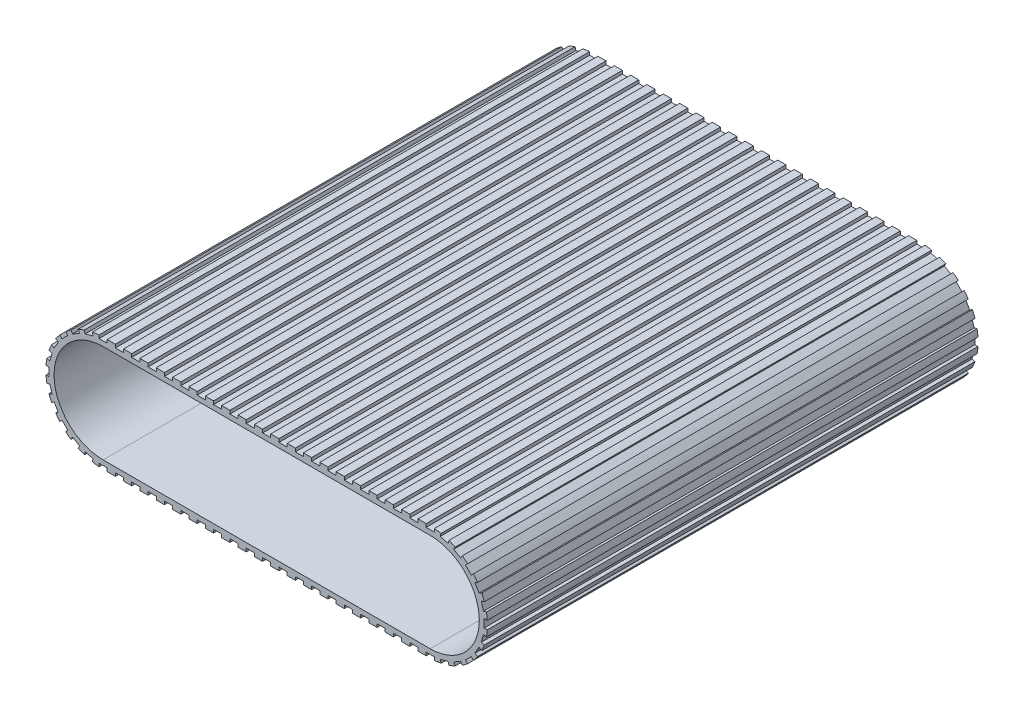
from build123d import *

# Parameters (mm, degrees)
EXTRUDE_1_DEPTH           = 150
SKETCH_2_W                = 5
SKETCH_2_H                = 300
CUT_EXTRUDE_1_DEPTH       = 2
SKETCH_3_W                = 300
SKETCH_3_H                = 5
CUT_EXTRUDE_2_DEPTH       = 2
PATTERN_CIRCULAR_1_COUNT  = 6
PATTERN_CIRCULAR_1_ANGLE  = 75
MIRROR_2_COPY_1_SKETCH_W  = 300
MIRROR_2_COPY_1_SKETCH_H  = 5
MIRROR_2_COPY_1_DEPTH     = 2
MIRROR_2_COPY_2_SKETCH_W  = 300
MIRROR_2_COPY_2_SKETCH_H  = 5
MIRROR_2_COPY_2_DEPTH     = 2
MIRROR_2_COPY_3_SKETCH_W  = 300
MIRROR_2_COPY_3_SKETCH_H  = 5
MIRROR_2_COPY_3_DEPTH     = 2
MIRROR_2_COPY_4_SKETCH_W  = 300
MIRROR_2_COPY_4_SKETCH_H  = 5
MIRROR_2_COPY_4_DEPTH     = 2
MIRROR_2_COPY_5_SKETCH_W  = 300
MIRROR_2_COPY_5_SKETCH_H  = 5
MIRROR_2_COPY_5_DEPTH     = 2
MIRROR_2_COPY_6_SKETCH_W  = 300
MIRROR_2_COPY_6_SKETCH_H  = 5
MIRROR_2_COPY_6_DEPTH     = 2
MIRROR_3_COPY_1_SKETCH_W  = 300
MIRROR_3_COPY_1_SKETCH_H  = 5
MIRROR_3_COPY_1_DEPTH     = 2
MIRROR_3_COPY_2_SKETCH_W  = 300
MIRROR_3_COPY_2_SKETCH_H  = 5
MIRROR_3_COPY_2_DEPTH     = 2
MIRROR_3_COPY_3_SKETCH_W  = 300
MIRROR_3_COPY_3_SKETCH_H  = 5
MIRROR_3_COPY_3_DEPTH     = 2
MIRROR_3_COPY_4_SKETCH_W  = 300
MIRROR_3_COPY_4_SKETCH_H  = 5
MIRROR_3_COPY_4_DEPTH     = 2
MIRROR_3_COPY_5_SKETCH_W  = 300
MIRROR_3_COPY_5_SKETCH_H  = 5
MIRROR_3_COPY_5_DEPTH     = 2
MIRROR_3_COPY_6_SKETCH_W  = 300
MIRROR_3_COPY_6_SKETCH_H  = 5
MIRROR_3_COPY_6_DEPTH     = 2
MIRROR_3_COPY_7_SKETCH_W  = 300
MIRROR_3_COPY_7_SKETCH_H  = 5
MIRROR_3_COPY_7_DEPTH     = 2
MIRROR_3_COPY_8_SKETCH_W  = 300
MIRROR_3_COPY_8_SKETCH_H  = 5
MIRROR_3_COPY_8_DEPTH     = 2
MIRROR_3_COPY_9_SKETCH_W  = 300
MIRROR_3_COPY_9_SKETCH_H  = 5
MIRROR_3_COPY_9_DEPTH     = 2
MIRROR_3_COPY_10_SKETCH_W = 300
MIRROR_3_COPY_10_SKETCH_H = 5
MIRROR_3_COPY_10_DEPTH    = 2
MIRROR_3_COPY_11_SKETCH_W = 300
MIRROR_3_COPY_11_SKETCH_H = 5
MIRROR_3_COPY_11_DEPTH    = 2
MIRROR_3_COPY_12_SKETCH_W = 300
MIRROR_3_COPY_12_SKETCH_H = 5
MIRROR_3_COPY_12_DEPTH    = 2
MIRROR_3_COPY_13_SKETCH_W = 300
MIRROR_3_COPY_13_SKETCH_H = 5
MIRROR_3_COPY_13_DEPTH    = 2


with BuildPart() as part:
    # 草图1 → 凸台-拉伸1 (new, symmetric)
    with BuildSketch(Plane.XY):
        with BuildLine():
            Line((-100, 35), (100, 35))
            ThreePointArc((100, 35), (135, 0), (100, -35))
            Line((100, -35), (-100, -35))
            ThreePointArc((-100, -35), (-135, 0), (-100, 35))
        make_face()
        with BuildLine():
            Line((-100, 30), (100, 30))
            ThreePointArc((100, 30), (130, 0), (100, -30))
            Line((100, -30), (-100, -30))
            ThreePointArc((-100, -30), (-130, 0), (-100, 30))
        make_face(mode=Mode.SUBTRACT)
    extrude(amount=EXTRUDE_1_DEPTH, both=True)

    # 草图2 → 切除-拉伸1 (cut)
    with BuildSketch(Plane(origin=(0, 35, 0), x_dir=(1, 0, 0), z_dir=(0, 1, 0))):
        Rectangle(SKETCH_2_W, SKETCH_2_H)
        with Locations((10, 0)):
            Rectangle(SKETCH_2_W, SKETCH_2_H)
        with Locations((20, 0)):
            Rectangle(SKETCH_2_W, SKETCH_2_H)
        with Locations((30, 0)):
            Rectangle(SKETCH_2_W, SKETCH_2_H)
        with Locations((40, 0)):
            Rectangle(SKETCH_2_W, SKETCH_2_H)
        with Locations((50, 0)):
            Rectangle(SKETCH_2_W, SKETCH_2_H)
        with Locations((60, 0)):
            Rectangle(SKETCH_2_W, SKETCH_2_H)
        with Locations((70, 0)):
            Rectangle(SKETCH_2_W, SKETCH_2_H)
        with Locations((80, 0)):
            Rectangle(SKETCH_2_W, SKETCH_2_H)
        with Locations((90, 0)):
            Rectangle(SKETCH_2_W, SKETCH_2_H)
        with Locations((100, 0)):
            Rectangle(SKETCH_2_W, SKETCH_2_H)
        with Locations((-100, 0)):
            Rectangle(SKETCH_2_W, SKETCH_2_H)
        with Locations((-90, 0)):
            Rectangle(SKETCH_2_W, SKETCH_2_H)
        with Locations((-80, 0)):
            Rectangle(SKETCH_2_W, SKETCH_2_H)
        with Locations((-70, 0)):
            Rectangle(SKETCH_2_W, SKETCH_2_H)
        with Locations((-60, 0)):
            Rectangle(SKETCH_2_W, SKETCH_2_H)
        with Locations((-50, 0)):
            Rectangle(SKETCH_2_W, SKETCH_2_H)
        with Locations((-40, 0)):
            Rectangle(SKETCH_2_W, SKETCH_2_H)
        with Locations((-30, 0)):
            Rectangle(SKETCH_2_W, SKETCH_2_H)
        with Locations((-20, 0)):
            Rectangle(SKETCH_2_W, SKETCH_2_H)
        with Locations((-10, 0)):
            Rectangle(SKETCH_2_W, SKETCH_2_H)
    cut_extrude_1 = extrude(amount=-CUT_EXTRUDE_1_DEPTH, mode=Mode.SUBTRACT)

    # 镜向1: 切除-拉伸1 across plane
    add(cut_extrude_1.mirror(Plane.ZX), mode=Mode.SUBTRACT)

    # 草图3 → 切除-拉伸2 (cut)
    with BuildSketch(Plane(origin=(135, 0, 0), x_dir=(0, 0, -1), z_dir=(1, 0, 0))):
        Rectangle(SKETCH_3_W, SKETCH_3_H)
    cut_extrude_2 = extrude(amount=-CUT_EXTRUDE_2_DEPTH, mode=Mode.SUBTRACT)

    # 阵列(圆周)1: 切除-拉伸2 ×6 about axis
    pattern_circular_1_axis = Axis((100, 0, 0), (0, 0, 1))
    for i in range(1, PATTERN_CIRCULAR_1_COUNT):
        add(cut_extrude_2.rotate(pattern_circular_1_axis, i * PATTERN_CIRCULAR_1_ANGLE / (PATTERN_CIRCULAR_1_COUNT - 1)), mode=Mode.SUBTRACT)

    # 镜向2 copy 1 sketch → 镜向2 copy 1 (cut)
    with BuildSketch(Plane(origin=(133.80740392, -9.058666579, 0), x_dir=(0, 0, -1), z_dir=(0.9659258262890681, -0.25881904510252135, 0))):
        Rectangle(MIRROR_2_COPY_1_SKETCH_W, MIRROR_2_COPY_1_SKETCH_H)
    extrude(amount=-MIRROR_2_COPY_1_DEPTH, mode=Mode.SUBTRACT)

    # 镜向2 copy 2 sketch → 镜向2 copy 2 (cut)
    with BuildSketch(Plane(origin=(130.310889132, -17.5, 0), x_dir=(0, 0, -1), z_dir=(0.866025403784438, -0.500000000000001, 0))):
        Rectangle(MIRROR_2_COPY_2_SKETCH_W, MIRROR_2_COPY_2_SKETCH_H)
    extrude(amount=-MIRROR_2_COPY_2_DEPTH, mode=Mode.SUBTRACT)

    # 镜向2 copy 3 sketch → 镜向2 copy 3 (cut)
    with BuildSketch(Plane(origin=(124.748737342, -24.748737342, 0), x_dir=(0, 0, -1), z_dir=(0.7071067811865462, -0.7071067811865488, 0))):
        Rectangle(MIRROR_2_COPY_3_SKETCH_W, MIRROR_2_COPY_3_SKETCH_H)
    extrude(amount=-MIRROR_2_COPY_3_DEPTH, mode=Mode.SUBTRACT)

    # 镜向2 copy 4 sketch → 镜向2 copy 4 (cut)
    with BuildSketch(Plane(origin=(117.5, -30.310889132, 0), x_dir=(0, 0, -1), z_dir=(0.499999999999998, -0.8660254037844398, 0))):
        Rectangle(MIRROR_2_COPY_4_SKETCH_W, MIRROR_2_COPY_4_SKETCH_H)
    extrude(amount=-MIRROR_2_COPY_4_DEPTH, mode=Mode.SUBTRACT)

    # 镜向2 copy 5 sketch → 镜向2 copy 5 (cut)
    with BuildSketch(Plane(origin=(109.058666579, -33.80740392, 0), x_dir=(0, 0, -1), z_dir=(0.25881904510251796, -0.9659258262890691, 0))):
        Rectangle(MIRROR_2_COPY_5_SKETCH_W, MIRROR_2_COPY_5_SKETCH_H)
    extrude(amount=-MIRROR_2_COPY_5_DEPTH, mode=Mode.SUBTRACT)

    # 镜向2 copy 6 sketch → 镜向2 copy 6 (cut)
    with BuildSketch(Plane(origin=(135, 0, 0), x_dir=(0, 0, -1), z_dir=(1, 0, 0))):
        Rectangle(MIRROR_2_COPY_6_SKETCH_W, MIRROR_2_COPY_6_SKETCH_H)
    extrude(amount=-MIRROR_2_COPY_6_DEPTH, mode=Mode.SUBTRACT)

    # 镜向3 copy 1 sketch → 镜向3 copy 1 (cut)
    with BuildSketch(Plane(origin=(-133.80740392, 9.058666579, 0), x_dir=(0, 0, -1), z_dir=(-0.9659258262890681, 0.25881904510252135, 0))):
        Rectangle(MIRROR_3_COPY_1_SKETCH_W, MIRROR_3_COPY_1_SKETCH_H)
    extrude(amount=-MIRROR_3_COPY_1_DEPTH, mode=Mode.SUBTRACT)

    # 镜向3 copy 2 sketch → 镜向3 copy 2 (cut)
    with BuildSketch(Plane(origin=(-130.310889132, 17.5, 0), x_dir=(0, 0, -1), z_dir=(-0.866025403784438, 0.500000000000001, 0))):
        Rectangle(MIRROR_3_COPY_2_SKETCH_W, MIRROR_3_COPY_2_SKETCH_H)
    extrude(amount=-MIRROR_3_COPY_2_DEPTH, mode=Mode.SUBTRACT)

    # 镜向3 copy 3 sketch → 镜向3 copy 3 (cut)
    with BuildSketch(Plane(origin=(-124.748737342, 24.748737342, 0), x_dir=(0, 0, -1), z_dir=(-0.7071067811865462, 0.7071067811865488, 0))):
        Rectangle(MIRROR_3_COPY_3_SKETCH_W, MIRROR_3_COPY_3_SKETCH_H)
    extrude(amount=-MIRROR_3_COPY_3_DEPTH, mode=Mode.SUBTRACT)

    # 镜向3 copy 4 sketch → 镜向3 copy 4 (cut)
    with BuildSketch(Plane(origin=(-117.5, 30.310889132, 0), x_dir=(0, 0, -1), z_dir=(-0.499999999999998, 0.8660254037844398, 0))):
        Rectangle(MIRROR_3_COPY_4_SKETCH_W, MIRROR_3_COPY_4_SKETCH_H)
    extrude(amount=-MIRROR_3_COPY_4_DEPTH, mode=Mode.SUBTRACT)

    # 镜向3 copy 5 sketch → 镜向3 copy 5 (cut)
    with BuildSketch(Plane(origin=(-109.058666579, 33.80740392, 0), x_dir=(0, 0, -1), z_dir=(-0.25881904510251796, 0.9659258262890691, 0))):
        Rectangle(MIRROR_3_COPY_5_SKETCH_W, MIRROR_3_COPY_5_SKETCH_H)
    extrude(amount=-MIRROR_3_COPY_5_DEPTH, mode=Mode.SUBTRACT)

    # 镜向3 copy 6 sketch → 镜向3 copy 6 (cut)
    with BuildSketch(Plane(origin=(-135, 0, 0), x_dir=(0, 0, -1), z_dir=(-1, 0, 0))):
        Rectangle(MIRROR_3_COPY_6_SKETCH_W, MIRROR_3_COPY_6_SKETCH_H)
    extrude(amount=-MIRROR_3_COPY_6_DEPTH, mode=Mode.SUBTRACT)

    # 镜向3 copy 7 sketch → 镜向3 copy 7 (cut)
    with BuildSketch(Plane(origin=(-133.80740392, -9.058666579, 0), x_dir=(0, 0, -1), z_dir=(-0.9659258262890681, -0.25881904510252135, 0))):
        Rectangle(MIRROR_3_COPY_7_SKETCH_W, MIRROR_3_COPY_7_SKETCH_H)
    extrude(amount=-MIRROR_3_COPY_7_DEPTH, mode=Mode.SUBTRACT)

    # 镜向3 copy 8 sketch → 镜向3 copy 8 (cut)
    with BuildSketch(Plane(origin=(-130.310889132, -17.5, 0), x_dir=(0, 0, -1), z_dir=(-0.866025403784438, -0.500000000000001, 0))):
        Rectangle(MIRROR_3_COPY_8_SKETCH_W, MIRROR_3_COPY_8_SKETCH_H)
    extrude(amount=-MIRROR_3_COPY_8_DEPTH, mode=Mode.SUBTRACT)

    # 镜向3 copy 9 sketch → 镜向3 copy 9 (cut)
    with BuildSketch(Plane(origin=(-124.748737342, -24.748737342, 0), x_dir=(0, 0, -1), z_dir=(-0.7071067811865462, -0.7071067811865488, 0))):
        Rectangle(MIRROR_3_COPY_9_SKETCH_W, MIRROR_3_COPY_9_SKETCH_H)
    extrude(amount=-MIRROR_3_COPY_9_DEPTH, mode=Mode.SUBTRACT)

    # 镜向3 copy 10 sketch → 镜向3 copy 10 (cut)
    with BuildSketch(Plane(origin=(-117.5, -30.310889132, 0), x_dir=(0, 0, -1), z_dir=(-0.499999999999998, -0.8660254037844398, 0))):
        Rectangle(MIRROR_3_COPY_10_SKETCH_W, MIRROR_3_COPY_10_SKETCH_H)
    extrude(amount=-MIRROR_3_COPY_10_DEPTH, mode=Mode.SUBTRACT)

    # 镜向3 copy 11 sketch → 镜向3 copy 11 (cut)
    with BuildSketch(Plane(origin=(-109.058666579, -33.80740392, 0), x_dir=(0, 0, -1), z_dir=(-0.25881904510251796, -0.9659258262890691, 0))):
        Rectangle(MIRROR_3_COPY_11_SKETCH_W, MIRROR_3_COPY_11_SKETCH_H)
    extrude(amount=-MIRROR_3_COPY_11_DEPTH, mode=Mode.SUBTRACT)

    # 镜向3 copy 12 sketch → 镜向3 copy 12 (cut)
    with BuildSketch(Plane(origin=(-135, 0, 0), x_dir=(0, 0, -1), z_dir=(-1, 0, 0))):
        Rectangle(MIRROR_3_COPY_12_SKETCH_W, MIRROR_3_COPY_12_SKETCH_H)
    extrude(amount=-MIRROR_3_COPY_12_DEPTH, mode=Mode.SUBTRACT)

    # 镜向3 copy 13 sketch → 镜向3 copy 13 (cut)
    with BuildSketch(Plane(origin=(-135, 0, 0), x_dir=(0, 0, -1), z_dir=(-1, 0, 0))):
        Rectangle(MIRROR_3_COPY_13_SKETCH_W, MIRROR_3_COPY_13_SKETCH_H)
    extrude(amount=-MIRROR_3_COPY_13_DEPTH, mode=Mode.SUBTRACT)


solid = part.part
